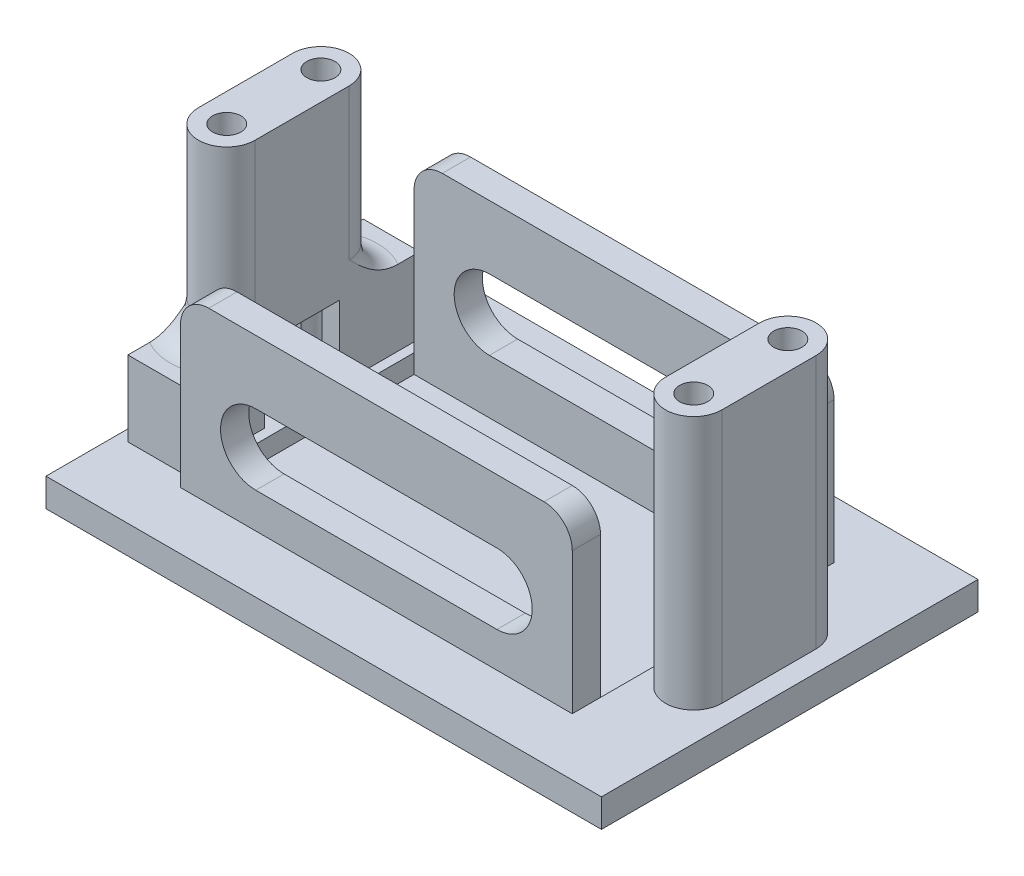
from build123d import *

# Parameters (mm, degrees)
SKETCH_1_W          = 55
SKETCH_1_H          = 40
SKETCH_1_R          = 1.5
EXTRUDE_1_DEPTH     = 3
SKETCH_2_W          = 40
SKETCH_2_H          = 3
EXTRUDE_2_DEPTH     = 4
CUT_EXTRUDE_1_REACH = 39.433
SKETCH_3_R          = 1.5
SKETCH_4_R          = 10.5
EXTRUDE_3_DEPTH     = 5
CUT_EXTRUDE_4_REACH = 40.646
CUT_EXTRUDE_START   = -1
SKETCH_5_W          = 41.614213562
SKETCH_5_H          = 21.814213562
SKETCH_6_R          = 1.5
EXTRUDE_5_DEPTH     = 27
SKETCH_7_W          = 6
SKETCH_7_H          = 25
SKETCH_7_R          = 1.5
EXTRUDE_6_DEPTH     = 8
CUT_EXTRUDE_5_REACH = 70.124
SKETCH_8_W          = 8
SKETCH_8_H          = 7.8
FILLET_1_R          = 3
FILLET_2_R          = 3
CUT_EXTRUDE_START_2 = -5
SKETCH_9_R          = 10.5
CUT_EXTRUDE_6_DEPTH = 5
SKETCH_10_W         = 41.614213562
SKETCH_10_H         = 3
EXTRUDE_7_DEPTH     = 18
FILLET_3_R          = 3
CUT_EXTRUDE_7_REACH = 57.154


with BuildPart() as part:
    # 草图1 → 凸台-拉伸1 (new body)
    with BuildSketch(Plane(origin=(0, 0, 0), x_dir=(1, 0, 0), z_dir=(0, 1, 0))):
        Rectangle(SKETCH_1_W, SKETCH_1_H)
        with Locations(Location((22.3, 5, 0), (0, 0, 270))):
            Circle(SKETCH_1_R, mode=Mode.SUBTRACT)
        with Locations(Location((22.3, -5, 0), (0, 0, 90))):
            Circle(SKETCH_1_R, mode=Mode.SUBTRACT)
    extrude(amount=EXTRUDE_1_DEPTH)

    # 草图2 → 凸台-拉伸2 (add)
    with BuildSketch(Plane.ZY.offset(27.5)):
        with Locations((0, 1.5)):
            Rectangle(SKETCH_2_W, SKETCH_2_H)
    extrude(amount=EXTRUDE_2_DEPTH)

    # 草图3 → 切除-拉伸1 (cut, up to next)
    with BuildSketch(Plane.XZ, mode=Mode.PRIVATE) as cut_extrude_1_sk1:
        with Locations(Location((-27.3, 5, 0), (0, 0, 270))):
            Circle(SKETCH_3_R)
    cut_extrude_1_tool1 = extrude(cut_extrude_1_sk1.sketch, amount=-CUT_EXTRUDE_1_REACH, mode=Mode.PRIVATE) & part.part
    # 草图3 → 切除-拉伸1 (cut, up to next)
    with BuildSketch(Plane.XZ, mode=Mode.PRIVATE) as cut_extrude_1_sk2:
        with Locations(Location((-27.3, -5, 0), (0, 0, 270))):
            Circle(SKETCH_3_R)
    cut_extrude_1_tool2 = extrude(cut_extrude_1_sk2.sketch, amount=-CUT_EXTRUDE_1_REACH, mode=Mode.PRIVATE) & part.part
    add(cut_extrude_1_tool1.solids().sort_by_distance((-27.3, 0, 5))[0], mode=Mode.SUBTRACT)
    add(cut_extrude_1_tool2.solids().sort_by_distance((-27.3, 0, -5))[0], mode=Mode.SUBTRACT)

    # 草图4 → 凸台-拉伸3 (add)
    with BuildSketch(Plane.XZ):
        with Locations(Location((-12.5, 0, 0), (0, 0, 90))):
            Circle(SKETCH_4_R)
    extrude(amount=EXTRUDE_3_DEPTH)

    # 草图5 → 切除-拉伸4 (cut, up to next)
    with BuildSketch(Plane.XZ.offset(CUT_EXTRUDE_START), mode=Mode.PRIVATE) as cut_extrude_4_sk1:
        with Locations((-2.5, 0)):
            Rectangle(SKETCH_5_W, SKETCH_5_H)
    cut_extrude_4_tool1 = extrude(cut_extrude_4_sk1.sketch, amount=-CUT_EXTRUDE_4_REACH, mode=Mode.PRIVATE) & part.part
    add(cut_extrude_4_tool1.solids().sort_by_distance((-2.5, 1, 0))[0], mode=Mode.SUBTRACT)

    # 草图6 → 凸台-拉伸5 (add)
    # profile 1 of 2: a face of its own
    with BuildSketch(Plane(origin=(0, 3, 0), x_dir=(1, 0, 0), z_dir=(0, 1, 0))):
        with BuildLine():
            Line((-30.3, -5), (-30.3, 5))
            ThreePointArc((-30.3, 5), (-27.3, 8), (-24.3, 5))
            Line((-24.3, 5), (-24.3, -5))
            ThreePointArc((-24.3, -5), (-27.3, -8), (-30.3, -5))
        make_face()
        with Locations(Location((-27.3, -5, 0), (0, 0, 90))):
            Circle(SKETCH_6_R, mode=Mode.SUBTRACT)
        with Locations(Location((-27.3, 5, 0), (0, 0, 90))):
            Circle(SKETCH_6_R, mode=Mode.SUBTRACT)
    # profile 2 of 2: a face of its own
    with BuildSketch(Plane(origin=(0, 3, 0), x_dir=(1, 0, 0), z_dir=(0, 1, 0))):
        with BuildLine():
            Line((19.3, -5), (19.3, 5))
            ThreePointArc((19.3, 5), (22.3, 8), (25.3, 5))
            Line((25.3, 5), (25.3, -5))
            ThreePointArc((25.3, -5), (22.3, -8), (19.3, -5))
        make_face()
        with Locations(Location((22.3, 5, 0), (0, 0, 270))):
            Circle(SKETCH_6_R, mode=Mode.SUBTRACT)
        with Locations(Location((22.3, -5, 0), (0, 0, 90))):
            Circle(SKETCH_6_R, mode=Mode.SUBTRACT)
    extrude(amount=EXTRUDE_5_DEPTH)

    # 草图7 → 凸台-拉伸6 (add)
    with BuildSketch(Plane(origin=(0, 3, 0), x_dir=(1, 0, 0), z_dir=(0, 1, 0))):
        with Locations((-27.3, 0)):
            Rectangle(SKETCH_7_W, SKETCH_7_H)
        with Locations(Location((-27.3, -5, 0), (0, 0, 90))):
            Circle(SKETCH_7_R, mode=Mode.SUBTRACT)
        with Locations(Location((-27.3, 5, 0), (0, 0, 90))):
            Circle(SKETCH_7_R, mode=Mode.SUBTRACT)
    extrude(amount=EXTRUDE_6_DEPTH)

    # 草图8 → 切除-拉伸5 (cut, up to next)
    with BuildSketch(Plane.ZY.offset(30.3), mode=Mode.PRIVATE) as cut_extrude_5_sk1:
        with Locations((0, 6.9)):
            Rectangle(SKETCH_8_W, SKETCH_8_H)
    cut_extrude_5_tool1 = extrude(cut_extrude_5_sk1.sketch, amount=-CUT_EXTRUDE_5_REACH, mode=Mode.PRIVATE) & part.part
    add(cut_extrude_5_tool1.solids().sort_by_distance((-30.3, 6.9, 0))[0], mode=Mode.SUBTRACT)

    # 圆角1
    fillet_1_edges = [part.edges().sort_by_distance(p)[0] for p in [
        (-27.3, 11, 8),
    ]]
    fillet(fillet_1_edges, radius=FILLET_1_R)

    # 圆角2
    fillet_2_edges = [part.edges().sort_by_distance(p)[0] for p in [
        (-27.3, 11, -8),
    ]]
    fillet(fillet_2_edges, radius=FILLET_2_R)

    # 草图9 → 切除-拉伸6 (cut)
    with BuildSketch(Plane.XZ.offset(5).offset(CUT_EXTRUDE_START_2)):
        with Locations((-12.5, 0)):
            Circle(SKETCH_9_R)
    extrude(amount=CUT_EXTRUDE_6_DEPTH, mode=Mode.SUBTRACT)

    # 草图10 → 凸台-拉伸7 (add)
    with BuildSketch(Plane(origin=(0, 3, 0), x_dir=(1, 0, 0), z_dir=(0, 1, 0))):
        with Locations((-2.5, 12.407106781)):
            Rectangle(SKETCH_10_W, SKETCH_10_H)
        with Locations((-2.5, -12.407106781)):
            Rectangle(SKETCH_10_W, SKETCH_10_H)
    extrude(amount=EXTRUDE_7_DEPTH)

    # 圆角3
    fillet_3_edges = [part.edges().sort_by_distance(p)[0] for p in [
        (-23.307106781, 21, -12.407106781),
        (18.307106781, 21, -12.407106781),
        (18.307106781, 21, 12.407106781),
        (-23.307106781, 21, 12.407106781),
    ]]
    fillet(fillet_3_edges, radius=FILLET_3_R)

    # 切除-拉伸7: up to this face of the body (flat: up to its plane)
    cut_extrude_7_end = Plane(part.part.faces().sort_by_distance((-2.5, 11.956820585, -13.907106781))[0])
    # 草图11 → 切除-拉伸7 (cut, up to the picked face)
    with BuildSketch(Plane.XY.offset(13.907106781), mode=Mode.PRIVATE) as cut_extrude_7_sk1:
        with BuildLine():
            Line((-15.307106781, 14.245523658), (10.307106781, 14.245523658))
            ThreePointArc((10.307106781, 14.245523658), (14.052630439, 10.5), (10.307106781, 6.754476342))
            Line((10.307106781, 6.754476342), (-15.307106781, 6.754476342))
            ThreePointArc((-15.307106781, 6.754476342), (-19.052630439, 10.5), (-15.307106781, 14.245523658))
        make_face()
    cut_extrude_7_tool1 = split(extrude(cut_extrude_7_sk1.sketch, amount=-CUT_EXTRUDE_7_REACH, mode=Mode.PRIVATE), bisect_by=cut_extrude_7_end, keep=Keep.BOTH, mode=Mode.PRIVATE)
    add(cut_extrude_7_tool1.solids().sort_by(Axis((-2.5, 10.5, 13.907107), (0, 0, -1)))[0], mode=Mode.SUBTRACT)


solid = part.part
